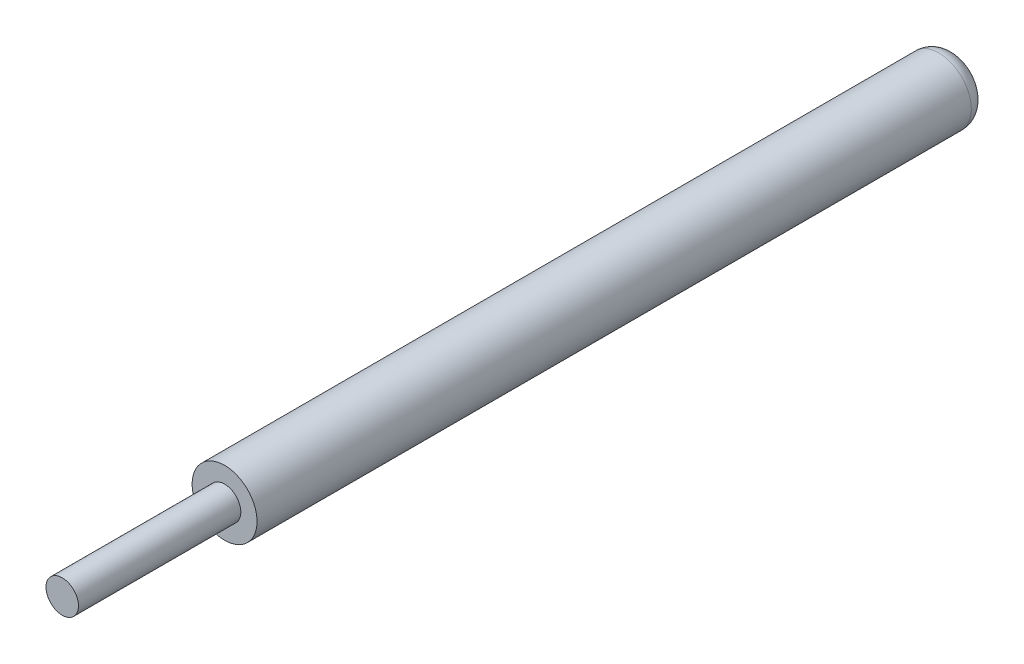
from build123d import *

# Parameters (mm, degrees)
SKETCH1_W = 6.985
SKETCH1_H = 0.254
FILLET1_R = 0.127
SKETCH3_W = 1.933566412
SKETCH3_H = 0.48292321


with BuildPart() as part:
    # Sketch1 → Revolve1 (revolve)
    with BuildSketch(Plane(origin=(0, 0, 0), x_dir=(0, 0, -1), z_dir=(1, 0, 0))):
        with Locations((2.2225, 0.127)):
            Rectangle(SKETCH1_W, SKETCH1_H)
    revolve(axis=Axis((0, 0, -5.715), (0, 0, 1)))

    # Fillet1
    fillet1_edges = [part.edges().sort_by_distance(p)[0] for p in [
        (0, -0.254, -5.715),
    ]]
    fillet(fillet1_edges, radius=FILLET1_R)

    # Sketch3 → Cut-Revolve1 (revolve, cut)
    with BuildSketch(Plane(origin=(0, 0, 0), x_dir=(0, 0, -1), z_dir=(1, 0, 0))):
        with Locations((-0.966783206, 0.368461605)):
            Rectangle(SKETCH3_W, SKETCH3_H)
    revolve(axis=Axis((0, 0, 1.618934624), (0, 0, 1)), mode=Mode.SUBTRACT)


solid = part.part
